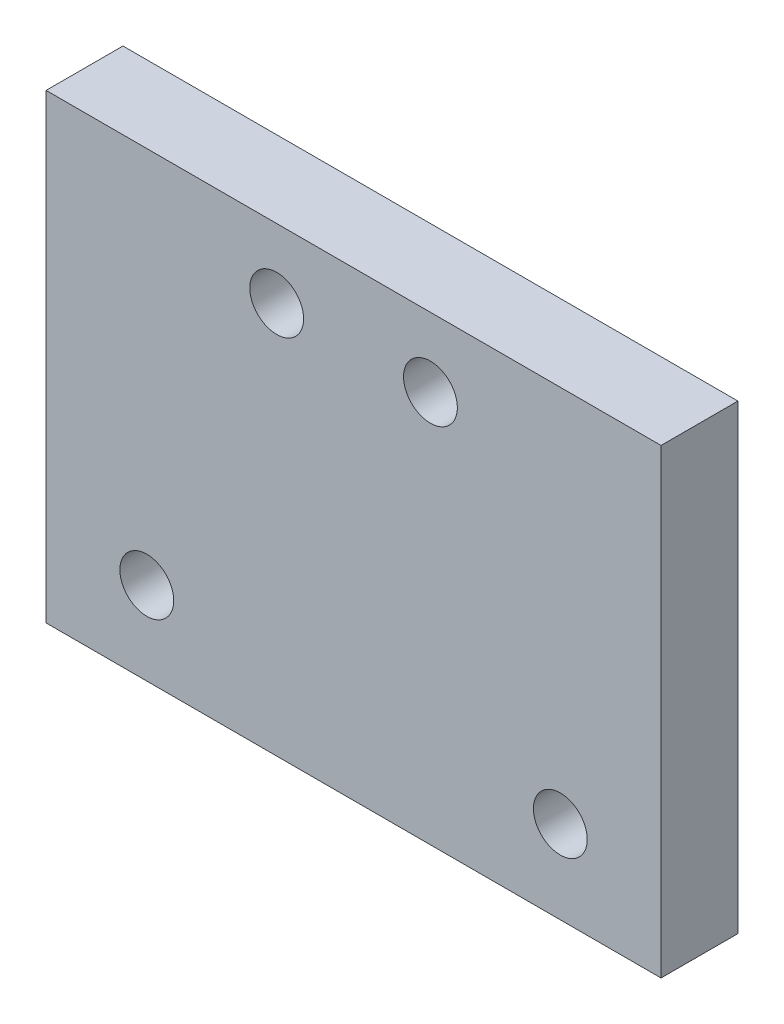
from build123d import *

# Parameters (mm, degrees)
SKETCH1_W           = 40
SKETCH1_H           = 30
SKETCH1_R           = 1.75
BOSS_EXTRUDE1_DEPTH = 5


with BuildPart() as part:
    # Sketch1 → Boss-Extrude1 (new body)
    with BuildSketch(Plane.XY):
        with Locations((20, 15)):
            Rectangle(SKETCH1_W, SKETCH1_H)
        with Locations((15, 25.5)):
            Circle(SKETCH1_R, mode=Mode.SUBTRACT)
        with Locations(Location((25, 25.5, 0), (0, 0, 180))):
            Circle(SKETCH1_R, mode=Mode.SUBTRACT)
        with Locations((6.55, 5.4)):
            Circle(SKETCH1_R, mode=Mode.SUBTRACT)
        with Locations(Location((33.45, 5.4, 0), (0, 0, 180))):
            Circle(SKETCH1_R, mode=Mode.SUBTRACT)
    extrude(amount=-BOSS_EXTRUDE1_DEPTH)


solid = part.part
